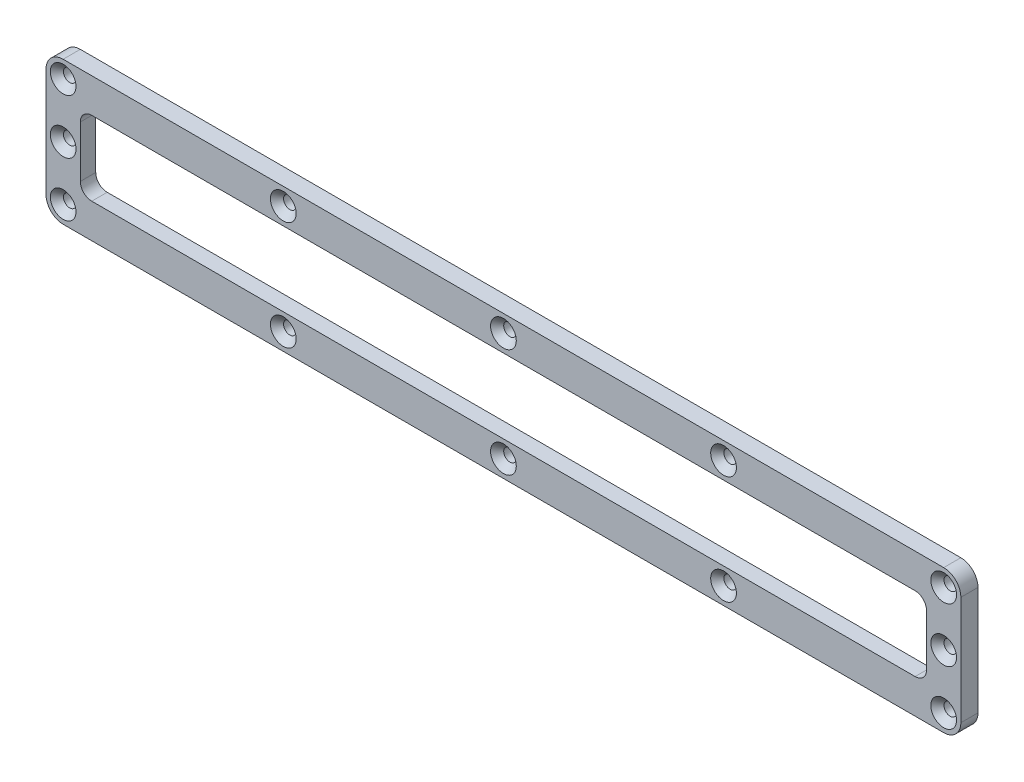
from build123d import *

# Parameters (mm, degrees)
SKETCH1_W                                            = 160
SKETCH1_H                                            = 25
BOSS_EXTRUDE1_DEPTH                                  = 1.5
SKETCH2_W                                            = 148
SKETCH2_H                                            = 13
CUT_EXTRUDE1_DEPTH                                   = 82.026230321
FILLET1_R                                            = 2
FILLET2_R                                            = 3
CSK_FOR_M2_SLOTTED_RAISED_CTSK_HEAD_SCRE_D           = 2.2
CSK_FOR_M2_SLOTTED_RAISED_CTSK_HEAD_SCRE_CSINK_D     = 4.5
CSK_FOR_M2_SLOTTED_RAISED_CTSK_HEAD_SCRE_CSINK_ANGLE = 90
MIRROR1_AT_THE_SECOND_PLANE_COPY_1_D                 = 2.2
MIRROR1_AT_THE_SECOND_PLANE_COPY_1_CSINK_D           = 4.5
MIRROR1_AT_THE_SECOND_PLANE_COPY_1_CSINK_ANGLE       = 90
SKETCH7_W                                            = 151
SKETCH7_H                                            = 16
CUT_EXTRUDE2_DEPTH                                   = 0.3
FILLET4_R                                            = 1


with BuildPart() as part:
    # Sketch1 → Boss-Extrude1 (new, symmetric)
    with BuildSketch(Plane.XY):
        Rectangle(SKETCH1_W, SKETCH1_H)
    extrude(amount=BOSS_EXTRUDE1_DEPTH, both=True)

    # Sketch2 → Cut-Extrude1 (cut, through all)
    with BuildSketch(Plane.XY.offset(1.5)):
        Rectangle(SKETCH2_W, SKETCH2_H)
    extrude(amount=-CUT_EXTRUDE1_DEPTH, mode=Mode.SUBTRACT)

    # Fillet1
    fillet1_edges = [part.edges().sort_by_distance(p)[0] for p in [
        (-74, -6.5, 0),
        (-74, 6.5, 0),
        (74, 6.5, 0),
        (74, -6.5, 0),
    ]]
    fillet(fillet1_edges, radius=FILLET1_R)

    # Fillet2
    fillet2_edges = [part.edges().sort_by_distance(p)[0] for p in [
        (80, -12.5, 0),
        (-80, -12.5, 0),
        (-80, 12.5, 0),
        (80, 12.5, 0),
    ]]
    fillet(fillet2_edges, radius=FILLET2_R)

    # CSK for M2 Slotted raised CTSK head screws1 (through all)
    with Locations(Plane(origin=(0, -9.5, 1.5), x_dir=(1, 0, 0), z_dir=(0, 0, 1))):
        with Locations((0, 0), (38.5, 0), (77, 0), (77, 9.5)):
            csk_for_m2_slotted_raised_ctsk_head_scre = CounterSinkHole(CSK_FOR_M2_SLOTTED_RAISED_CTSK_HEAD_SCRE_D / 2, CSK_FOR_M2_SLOTTED_RAISED_CTSK_HEAD_SCRE_CSINK_D / 2, counter_sink_angle=CSK_FOR_M2_SLOTTED_RAISED_CTSK_HEAD_SCRE_CSINK_ANGLE)

    # Mirror1: CSK for M2 Slotted raised CTSK head screws1 across plane
    add(csk_for_m2_slotted_raised_ctsk_head_scre.mirror(Plane.ZX), mode=Mode.SUBTRACT)

    # Mirror1 at the second plane: CSK for M2 Slotted raised CTSK head screws1 across plane
    add(csk_for_m2_slotted_raised_ctsk_head_scre.mirror(Plane(origin=(0, 0, 0), x_dir=(0, 0, 1), z_dir=(1, 0, 0))), mode=Mode.SUBTRACT)

    # Mirror1 at the second plane copy 1 (through all)
    with Locations(Plane(origin=(0, 9.5, 1.5), x_dir=(-1, 0, 0), z_dir=(0, 0, 1))):
        with Locations((0, 0), (38.5, 0), (77, 0), (77, 9.5)):
            CounterSinkHole(MIRROR1_AT_THE_SECOND_PLANE_COPY_1_D / 2, MIRROR1_AT_THE_SECOND_PLANE_COPY_1_CSINK_D / 2, counter_sink_angle=MIRROR1_AT_THE_SECOND_PLANE_COPY_1_CSINK_ANGLE)

    # Sketch7 → Cut-Extrude2 (cut)
    with BuildSketch(Plane(origin=(0, 0, -1.5), x_dir=(-1, 0, 0), z_dir=(0, 0, -1))):
        Rectangle(SKETCH7_W, SKETCH7_H)
    extrude(amount=-CUT_EXTRUDE2_DEPTH, mode=Mode.SUBTRACT)

    # Fillet4
    fillet4_edges = [part.edges().sort_by_distance(p)[0] for p in [
        (75.5, -8, -1.35),
        (75.5, 8, -1.35),
        (-75.5, 8, -1.35),
        (-75.5, -8, -1.35),
    ]]
    fillet(fillet4_edges, radius=FILLET4_R)


solid = part.part
